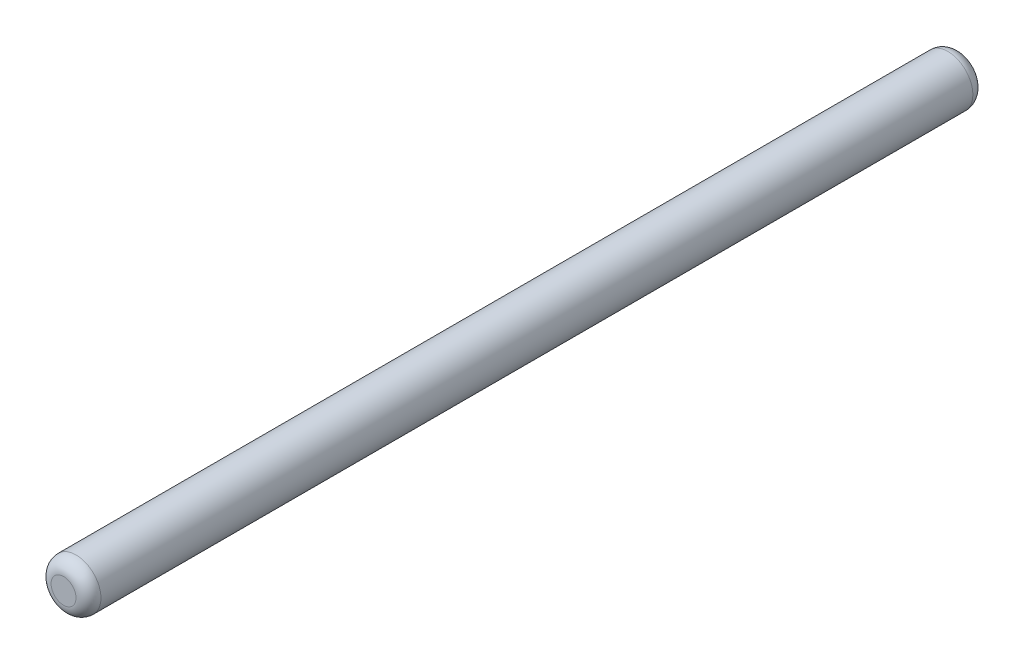
from build123d import *

# Parameters (mm, degrees)
SKETCH1_R           = 4
BOSS_EXTRUDE1_DEPTH = 144
FILLET1_R           = 2


with BuildPart() as part:
    # Sketch1 → Boss-Extrude1 (new body)
    with BuildSketch(Plane.XY):
        Circle(SKETCH1_R)
    extrude(amount=BOSS_EXTRUDE1_DEPTH)

    # Fillet1
    fillet1_edges = [part.edges().sort_by_distance(p)[0] for p in [
        (-4, 0, 0),
        (-4, 0, 144),
    ]]
    fillet(fillet1_edges, radius=FILLET1_R)


solid = part.part
